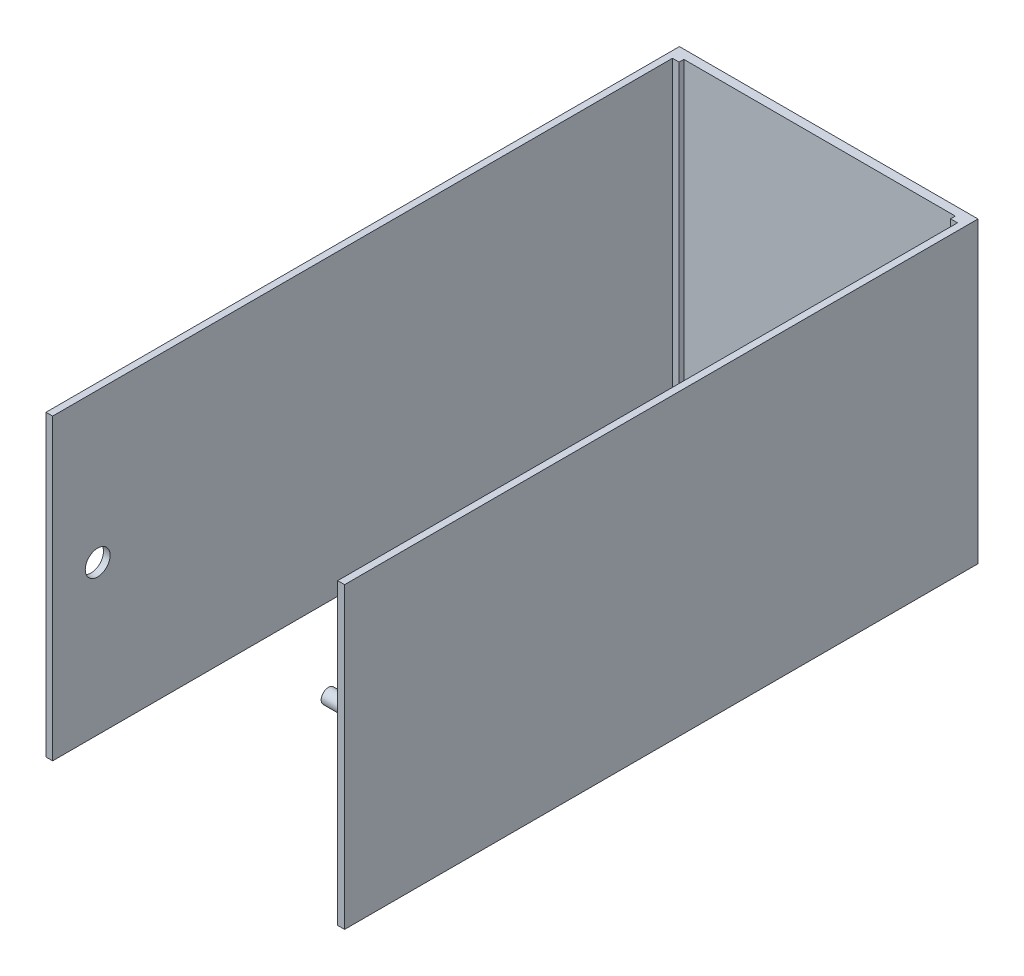
from build123d import *

# Parameters (mm, degrees)
ESBO_O1_R                = 5
RESSALTO_EXTRUS_O2_DEPTH = 10
ESBO_O3_R                = 2.5
CORTE_EXTRUS_O2_DEPTH    = 3
ESBO_O4_W                = 66
ESBO_O4_H                = 66
RESSALTO_EXTRUS_O3_DEPTH = 60
ESBO_O5_W                = 60
ESBO_O5_H                = 63
CORTE_EXTRUS_O3_DEPTH    = 57
ESBO_O6_W                = 60
ESBO_O6_H                = 59
CORTE_EXTRUS_O5_DEPTH    = 84
ESBO_O7_W                = 2.941982117
ESBO_O7_H                = 66
ESBO_O7_W_2              = 3.058017883
RESSALTO_EXTRUS_O4_DEPTH = 80
ESBO_O8_W                = 1.470991058
ESBO_O8_H                = 66
ESBO_O8_W_2              = 1.529008942
CORTE_EXTRUS_O6_DEPTH    = 137
ESBO_O9_R                = 2.75
CORTE_EXTRUS_O7_DEPTH    = 49
ESBO_O10_R               = 1.6
RESSALTO_EXTRUS_O5_DEPTH = 12


with BuildPart() as part:
    # Esboço1 → Ressalto-extrusão2 (new body)
    with BuildSketch(Plane.XY):
        Circle(ESBO_O1_R)
    extrude(amount=RESSALTO_EXTRUS_O2_DEPTH)

    # Esboço3 → Corte-extrusão2 (cut)
    with BuildSketch(Plane(origin=(0, 0, 0), x_dir=(-1, 0, 0), z_dir=(0, 0, -1))):
        Circle(ESBO_O3_R)
    extrude(amount=-CORTE_EXTRUS_O2_DEPTH, mode=Mode.SUBTRACT)

    # Esboço4 → Ressalto-extrusão3 (add)
    with BuildSketch(Plane.XY.offset(10)):
        Rectangle(ESBO_O4_W, ESBO_O4_H)
    extrude(amount=RESSALTO_EXTRUS_O3_DEPTH)

    # Esboço5 → Corte-extrusão3 (cut)
    with BuildSketch(Plane.XY.offset(70)):
        Rectangle(ESBO_O5_W, ESBO_O5_H)
    extrude(amount=-CORTE_EXTRUS_O3_DEPTH, mode=Mode.SUBTRACT)

    # Esboço6 → Corte-extrusão5 (cut)
    with BuildSketch(Plane(origin=(0, 33, 0), x_dir=(1, 0, 0), z_dir=(0, 1, 0))):
        with Locations((-0.058017883, -41.456168944)):
            Rectangle(ESBO_O6_W, ESBO_O6_H)
    extrude(amount=-CORTE_EXTRUS_O5_DEPTH, mode=Mode.SUBTRACT)

    # Esboço7 → Ressalto-extrusão4 (add)
    with BuildSketch(Plane.XY.offset(70)):
        with Locations((-31.529008942, 0)):
            Rectangle(ESBO_O7_W, ESBO_O7_H)
        with Locations((31.470991059, 0)):
            Rectangle(ESBO_O7_W_2, ESBO_O7_H)
    extrude(amount=RESSALTO_EXTRUS_O4_DEPTH)

    # Esboço8 → Corte-extrusão6 (cut)
    with BuildSketch(Plane.XY.offset(150)):
        with Locations((-30.793513412, 0)):
            Rectangle(ESBO_O8_W, ESBO_O8_H)
        with Locations((30.706486588, 0)):
            Rectangle(ESBO_O8_W_2, ESBO_O8_H)
    extrude(amount=-CORTE_EXTRUS_O6_DEPTH, mode=Mode.SUBTRACT)

    # Esboço9 → Corte-extrusão7 (cut)
    with BuildSketch(Plane.ZY.offset(33)):
        with Locations(Location((140.048047336, 0, 0), (0, 0, 270))):
            Circle(ESBO_O9_R)
    extrude(amount=-CORTE_EXTRUS_O7_DEPTH, mode=Mode.SUBTRACT)

    # Esboço10 → Ressalto-extrusão5 (add)
    with BuildSketch(Plane.ZY.offset(-31.470991059)):
        with Locations(Location((140.048047336, 0, 0), (0, 0, 180))):
            Circle(ESBO_O10_R)
    extrude(amount=RESSALTO_EXTRUS_O5_DEPTH)


solid = part.part
